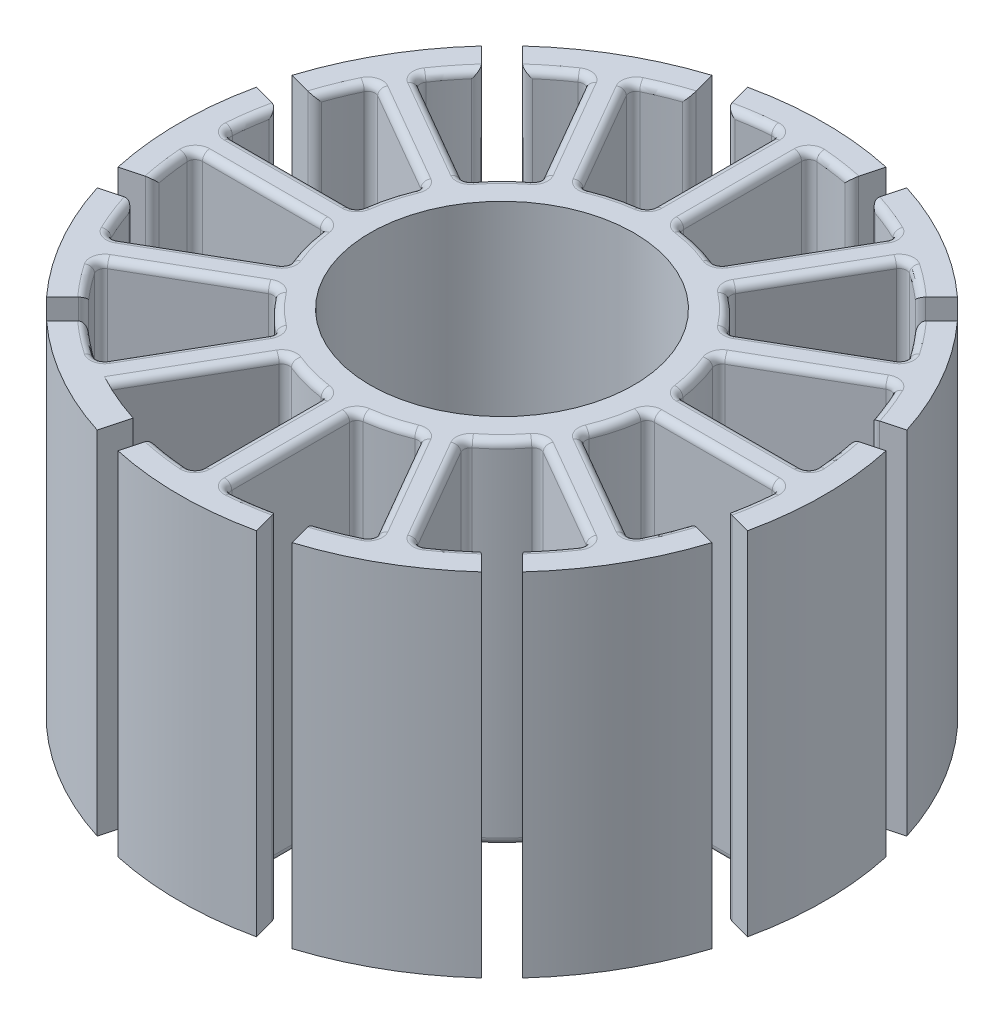
from build123d import *

# Parameters (mm, degrees)
SKETCH1_R           = 5.5
SKETCH1_R_2         = 4.5
BOSS_EXTRUDE1_DEPTH = 12
FILLET2_R           = 0.25


with BuildPart() as part:
    # Sketch1 → Boss-Extrude1 (new body)
    # profile 1 of 25: a face of its own
    with BuildSketch(Plane(origin=(0, 0, 0), x_dir=(1, 0, 0), z_dir=(0, 1, 0))):
        Circle(SKETCH1_R)
        with Locations(Location((0, 0, 0), (0, 0, 270))):
            Circle(SKETCH1_R_2, mode=Mode.SUBTRACT)
    # profile 2 of 25: a face of its own
    with BuildSketch(Plane(origin=(0, 0, 0), x_dir=(1, 0, 0), z_dir=(0, 1, 0))):
        with BuildLine():
            ThreePointArc((-4.49341649, -3.171625489), (-4.763139721, -2.75), (-4.99341649, -2.305600086))
            Line((-4.99341649, -2.305600086), (-8.899421946, -4.560733387))
            ThreePointArc((-8.899421946, -4.560733387), (-8.660254038, -5), (-8.399421946, -5.426758791))
            Line((-8.399421946, -5.426758791), (-4.49341649, -3.171625489))
        make_face()
    # profile 3 of 25: a face of its own
    with BuildSketch(Plane(origin=(0, 0, 0), x_dir=(1, 0, 0), z_dir=(0, 1, 0))):
        with BuildLine():
            ThreePointArc((-5.477225575, -0.5), (-5.5, 0), (-5.477225575, 0.5))
            Line((-5.477225575, 0.5), (-9.987492178, 0.5))
            ThreePointArc((-9.987492178, 0.5), (-10, 0), (-9.987492178, -0.5))
            Line((-9.987492178, -0.5), (-5.477225575, -0.5))
        make_face()
    # profile 4 of 25: a face of its own
    with BuildSketch(Plane(origin=(0, 0, 0), x_dir=(1, 0, 0), z_dir=(0, 1, 0))):
        with BuildLine():
            ThreePointArc((-4.99341649, 2.305600086), (-4.763139721, 2.75), (-4.49341649, 3.171625489))
            Line((-4.49341649, 3.171625489), (-8.399421946, 5.426758791))
            ThreePointArc((-8.399421946, 5.426758791), (-8.660254038, 5), (-8.899421946, 4.560733387))
            Line((-8.899421946, 4.560733387), (-4.99341649, 2.305600086))
        make_face()
    # profile 5 of 25: a face of its own
    with BuildSketch(Plane(origin=(0, 0, 0), x_dir=(1, 0, 0), z_dir=(0, 1, 0))):
        with BuildLine():
            ThreePointArc((-3.171625489, 4.49341649), (-2.75, 4.763139721), (-2.305600086, 4.99341649))
            Line((-2.305600086, 4.99341649), (-4.560733387, 8.899421946))
            ThreePointArc((-4.560733387, 8.899421946), (-5, 8.660254038), (-5.426758791, 8.399421946))
            Line((-5.426758791, 8.399421946), (-3.171625489, 4.49341649))
        make_face()
    # profile 6 of 25: a face of its own
    with BuildSketch(Plane(origin=(0, 0, 0), x_dir=(1, 0, 0), z_dir=(0, 1, 0))):
        with BuildLine():
            ThreePointArc((0.5, 9.987492178), (0, 10), (-0.5, 9.987492178))
            Line((-0.5, 9.987492178), (-0.5, 5.477225575))
            ThreePointArc((-0.5, 5.477225575), (0, 5.5), (0.5, 5.477225575))
            Line((0.5, 5.477225575), (0.5, 9.987492178))
        make_face()
    # profile 7 of 25: a face of its own
    with BuildSketch(Plane(origin=(0, 0, 0), x_dir=(1, 0, 0), z_dir=(0, 1, 0))):
        with BuildLine():
            Line((4.560733387, 8.899421946), (2.305600086, 4.99341649))
            ThreePointArc((2.305600086, 4.99341649), (2.75, 4.763139721), (3.171625489, 4.49341649))
            Line((3.171625489, 4.49341649), (5.426758791, 8.399421946))
            ThreePointArc((5.426758791, 8.399421946), (5, 8.660254038), (4.560733387, 8.899421946))
        make_face()
    # profile 8 of 25: a face of its own
    with BuildSketch(Plane(origin=(0, 0, 0), x_dir=(1, 0, 0), z_dir=(0, 1, 0))):
        with BuildLine():
            Line((8.399421946, 5.426758791), (4.49341649, 3.171625489))
            ThreePointArc((4.49341649, 3.171625489), (4.763139721, 2.75), (4.99341649, 2.305600086))
            Line((4.99341649, 2.305600086), (8.899421946, 4.560733387))
            ThreePointArc((8.899421946, 4.560733387), (8.660254038, 5), (8.399421946, 5.426758791))
        make_face()
    # profile 9 of 25: a face of its own
    with BuildSketch(Plane(origin=(0, 0, 0), x_dir=(1, 0, 0), z_dir=(0, 1, 0))):
        with BuildLine():
            Line((9.987492178, 0.5), (5.477225575, 0.5))
            ThreePointArc((5.477225575, 0.5), (5.494303444, 0.250259203), (5.5, 0))
            ThreePointArc((5.5, 0), (5.494303444, -0.250259203), (5.477225575, -0.5))
            Line((5.477225575, -0.5), (9.987492178, -0.5))
            ThreePointArc((9.987492178, -0.5), (9.996872555, -0.250078211), (10, 0))
            ThreePointArc((10, 0), (9.996872555, 0.250078211), (9.987492178, 0.5))
        make_face()
    # profile 10 of 25: a face of its own
    with BuildSketch(Plane(origin=(0, 0, 0), x_dir=(1, 0, 0), z_dir=(0, 1, 0))):
        with BuildLine():
            Line((8.899421946, -4.560733387), (4.99341649, -2.305600086))
            ThreePointArc((4.99341649, -2.305600086), (4.763139721, -2.75), (4.49341649, -3.171625489))
            Line((4.49341649, -3.171625489), (8.399421946, -5.426758791))
            ThreePointArc((8.399421946, -5.426758791), (8.660254038, -5), (8.899421946, -4.560733387))
        make_face()
    # profile 11 of 25: a face of its own
    with BuildSketch(Plane(origin=(0, 0, 0), x_dir=(1, 0, 0), z_dir=(0, 1, 0))):
        with BuildLine():
            Line((5.426758791, -8.399421946), (3.171625489, -4.49341649))
            ThreePointArc((3.171625489, -4.49341649), (2.75, -4.763139721), (2.305600086, -4.99341649))
            Line((2.305600086, -4.99341649), (4.560733387, -8.899421946))
            ThreePointArc((4.560733387, -8.899421946), (5, -8.660254038), (5.426758791, -8.399421946))
        make_face()
    # profile 12 of 25: a face of its own
    with BuildSketch(Plane(origin=(0, 0, 0), x_dir=(1, 0, 0), z_dir=(0, 1, 0))):
        with BuildLine():
            ThreePointArc((0.5, -5.477225575), (0, -5.5), (-0.5, -5.477225575))
            Line((-0.5, -5.477225575), (-0.5, -9.987492178))
            ThreePointArc((-0.5, -9.987492178), (0, -10), (0.5, -9.987492178))
            Line((0.5, -9.987492178), (0.5, -5.477225575))
        make_face()
    # profile 13 of 25: a face of its own
    with BuildSketch(Plane(origin=(0, 0, 0), x_dir=(1, 0, 0), z_dir=(0, 1, 0))):
        with BuildLine():
            ThreePointArc((-2.305600086, -4.99341649), (-2.75, -4.763139721), (-3.171625489, -4.49341649))
            Line((-3.171625489, -4.49341649), (-5.426758791, -8.399421946))
            ThreePointArc((-5.426758791, -8.399421946), (-5, -8.660254038), (-4.560733387, -8.899421946))
            Line((-4.560733387, -8.899421946), (-2.305600086, -4.99341649))
        make_face()
    # profile 14 of 25: a face of its own
    with BuildSketch(Plane(origin=(0, 0, 0), x_dir=(1, 0, 0), z_dir=(0, 1, 0))):
        with BuildLine():
            ThreePointArc((-4.560733387, -8.899421946), (-5, -8.660254038), (-5.426758791, -8.399421946))
            ThreePointArc((-5.426758791, -8.399421946), (-6.08761429, -7.933533403), (-6.708670055, -7.415776837))
            Line((-6.708670055, -7.415776837), (-7.416581743, -8.123688525))
            ThreePointArc((-7.416581743, -8.123688525), (-5.5, -9.526279442), (-3.327029763, -10.484792461))
            Line((-3.327029763, -10.484792461), (-3.067916102, -9.517767112))
            ThreePointArc((-3.067916102, -9.517767112), (-3.826834324, -9.238795325), (-4.560733387, -8.899421946))
        make_face()
    # profile 15 of 25: a face of its own
    with BuildSketch(Plane(origin=(0, 0, 0), x_dir=(1, 0, 0), z_dir=(0, 1, 0))):
        with BuildLine():
            ThreePointArc((-8.399421946, -5.426758791), (-8.660254038, -5), (-8.899421946, -4.560733387))
            ThreePointArc((-8.899421946, -4.560733387), (-9.238795325, -3.826834324), (-9.517767112, -3.067916102))
            Line((-9.517767112, -3.067916102), (-10.484792461, -3.327029763))
            ThreePointArc((-10.484792461, -3.327029763), (-9.526279442, -5.5), (-8.123688525, -7.416581743))
            Line((-8.123688525, -7.416581743), (-7.415776837, -6.708670055))
            ThreePointArc((-7.415776837, -6.708670055), (-7.933533403, -6.08761429), (-8.399421946, -5.426758791))
        make_face()
    # profile 16 of 25: a face of its own
    with BuildSketch(Plane(origin=(0, 0, 0), x_dir=(1, 0, 0), z_dir=(0, 1, 0))):
        with BuildLine():
            ThreePointArc((-9.987492178, -0.5), (-10, 0), (-9.987492178, 0.5))
            ThreePointArc((-9.987492178, 0.5), (-9.914448614, 1.305261922), (-9.776586157, 2.101990275))
            Line((-9.776586157, 2.101990275), (-10.743611506, 2.361103937))
            ThreePointArc((-10.743611506, 2.361103937), (-11, 0), (-10.743611506, -2.361103937))
            Line((-10.743611506, -2.361103937), (-9.776586157, -2.101990275))
            ThreePointArc((-9.776586157, -2.101990275), (-9.914448614, -1.305261922), (-9.987492178, -0.5))
        make_face()
    # profile 17 of 25: a face of its own
    with BuildSketch(Plane(origin=(0, 0, 0), x_dir=(1, 0, 0), z_dir=(0, 1, 0))):
        with BuildLine():
            ThreePointArc((-4.560733387, 8.899421946), (-3.826834324, 9.238795325), (-3.067916102, 9.517767112))
            Line((-3.067916102, 9.517767112), (-3.327029763, 10.484792461))
            ThreePointArc((-3.327029763, 10.484792461), (-5.5, 9.526279442), (-7.416581743, 8.123688525))
            Line((-7.416581743, 8.123688525), (-6.708670055, 7.415776837))
            ThreePointArc((-6.708670055, 7.415776837), (-6.08761429, 7.933533403), (-5.426758791, 8.399421946))
            ThreePointArc((-5.426758791, 8.399421946), (-5, 8.660254038), (-4.560733387, 8.899421946))
        make_face()
    # profile 18 of 25: a face of its own
    with BuildSketch(Plane(origin=(0, 0, 0), x_dir=(1, 0, 0), z_dir=(0, 1, 0))):
        with BuildLine():
            ThreePointArc((-8.899421946, 4.560733387), (-8.660254038, 5), (-8.399421946, 5.426758791))
            ThreePointArc((-8.399421946, 5.426758791), (-7.933533403, 6.08761429), (-7.415776837, 6.708670055))
            Line((-7.415776837, 6.708670055), (-8.123688525, 7.416581743))
            ThreePointArc((-8.123688525, 7.416581743), (-9.526279442, 5.5), (-10.484792461, 3.327029763))
            Line((-10.484792461, 3.327029763), (-9.517767112, 3.067916102))
            ThreePointArc((-9.517767112, 3.067916102), (-9.238795325, 3.826834324), (-8.899421946, 4.560733387))
        make_face()
    # profile 19 of 25: a face of its own
    with BuildSketch(Plane(origin=(0, 0, 0), x_dir=(1, 0, 0), z_dir=(0, 1, 0))):
        with BuildLine():
            ThreePointArc((-2.101990275, 9.776586157), (-1.305261922, 9.914448614), (-0.5, 9.987492178))
            ThreePointArc((-0.5, 9.987492178), (0, 10), (0.5, 9.987492178))
            ThreePointArc((0.5, 9.987492178), (1.305261922, 9.914448614), (2.101990275, 9.776586157))
            Line((2.101990275, 9.776586157), (2.361103937, 10.743611506))
            ThreePointArc((2.361103937, 10.743611506), (0, 11), (-2.361103937, 10.743611506))
            Line((-2.361103937, 10.743611506), (-2.101990275, 9.776586157))
        make_face()
    # profile 20 of 25: a face of its own
    with BuildSketch(Plane(origin=(0, 0, 0), x_dir=(1, 0, 0), z_dir=(0, 1, 0))):
        with BuildLine():
            Line((3.327029763, 10.484792461), (3.067916102, 9.517767112))
            ThreePointArc((3.067916102, 9.517767112), (3.826834324, 9.238795325), (4.560733387, 8.899421946))
            ThreePointArc((4.560733387, 8.899421946), (5, 8.660254038), (5.426758791, 8.399421946))
            ThreePointArc((5.426758791, 8.399421946), (6.08761429, 7.933533403), (6.708670055, 7.415776837))
            Line((6.708670055, 7.415776837), (7.416581743, 8.123688525))
            ThreePointArc((7.416581743, 8.123688525), (5.5, 9.526279442), (3.327029763, 10.484792461))
        make_face()
    # profile 21 of 25: a face of its own
    with BuildSketch(Plane(origin=(0, 0, 0), x_dir=(1, 0, 0), z_dir=(0, 1, 0))):
        with BuildLine():
            ThreePointArc((7.415776837, 6.708670055), (7.933533403, 6.08761429), (8.399421946, 5.426758791))
            ThreePointArc((8.399421946, 5.426758791), (8.660254038, 5), (8.899421946, 4.560733387))
            ThreePointArc((8.899421946, 4.560733387), (9.238795325, 3.826834324), (9.517767112, 3.067916102))
            Line((9.517767112, 3.067916102), (10.484792461, 3.327029763))
            ThreePointArc((10.484792461, 3.327029763), (9.526279442, 5.5), (8.123688525, 7.416581743))
            Line((8.123688525, 7.416581743), (7.415776837, 6.708670055))
        make_face()
    # profile 22 of 25: a face of its own
    with BuildSketch(Plane(origin=(0, 0, 0), x_dir=(1, 0, 0), z_dir=(0, 1, 0))):
        with BuildLine():
            ThreePointArc((9.776586157, 2.101990275), (9.914448614, 1.305261922), (9.987492178, 0.5))
            ThreePointArc((9.987492178, 0.5), (9.996872555, 0.250078211), (10, 0))
            ThreePointArc((10, 0), (9.996872555, -0.250078211), (9.987492178, -0.5))
            ThreePointArc((9.987492178, -0.5), (9.914448614, -1.305261922), (9.776586157, -2.101990275))
            Line((9.776586157, -2.101990275), (10.743611506, -2.361103937))
            ThreePointArc((10.743611506, -2.361103937), (10.935715033, -1.187491775), (11, 0))
            ThreePointArc((11, 0), (10.935715033, 1.187491775), (10.743611506, 2.361103937))
            Line((10.743611506, 2.361103937), (9.776586157, 2.101990275))
        make_face()
    # profile 23 of 25: a face of its own
    with BuildSketch(Plane(origin=(0, 0, 0), x_dir=(1, 0, 0), z_dir=(0, 1, 0))):
        with BuildLine():
            ThreePointArc((9.517767112, -3.067916102), (9.238795325, -3.826834324), (8.899421946, -4.560733387))
            ThreePointArc((8.899421946, -4.560733387), (8.660254038, -5), (8.399421946, -5.426758791))
            ThreePointArc((8.399421946, -5.426758791), (7.933533403, -6.08761429), (7.415776837, -6.708670055))
            Line((7.415776837, -6.708670055), (8.123688525, -7.416581743))
            ThreePointArc((8.123688525, -7.416581743), (9.526279442, -5.5), (10.484792461, -3.327029763))
            Line((10.484792461, -3.327029763), (9.517767112, -3.067916102))
        make_face()
    # profile 24 of 25: a face of its own
    with BuildSketch(Plane(origin=(0, 0, 0), x_dir=(1, 0, 0), z_dir=(0, 1, 0))):
        with BuildLine():
            ThreePointArc((6.708670055, -7.415776837), (6.08761429, -7.933533403), (5.426758791, -8.399421946))
            ThreePointArc((5.426758791, -8.399421946), (5, -8.660254038), (4.560733387, -8.899421946))
            ThreePointArc((4.560733387, -8.899421946), (3.826834324, -9.238795325), (3.067916102, -9.517767112))
            Line((3.067916102, -9.517767112), (3.327029763, -10.484792461))
            ThreePointArc((3.327029763, -10.484792461), (5.5, -9.526279442), (7.416581743, -8.123688525))
            Line((7.416581743, -8.123688525), (6.708670055, -7.415776837))
        make_face()
    # profile 25 of 25: a face of its own
    with BuildSketch(Plane(origin=(0, 0, 0), x_dir=(1, 0, 0), z_dir=(0, 1, 0))):
        with BuildLine():
            ThreePointArc((0.5, -9.987492178), (0, -10), (-0.5, -9.987492178))
            ThreePointArc((-0.5, -9.987492178), (-1.305261922, -9.914448614), (-2.101990275, -9.776586157))
            Line((-2.101990275, -9.776586157), (-2.361103937, -10.743611506))
            ThreePointArc((-2.361103937, -10.743611506), (0, -11), (2.361103937, -10.743611506))
            Line((2.361103937, -10.743611506), (2.101990275, -9.776586157))
            ThreePointArc((2.101990275, -9.776586157), (1.305261922, -9.914448614), (0.5, -9.987492178))
        make_face()
    extrude(amount=BOSS_EXTRUDE1_DEPTH)

    # Fillet2
    fillet2_edges = [part.edges().sort_by_distance(p)[0] for p in [
        (0.5, 0, 7.732358876),
        (0.5, 12, 7.732358876),
        (3.433166736, 0, 6.946419218),
        (3.433166736, 12, 6.946419218),
        (-3.433166736, 0, 6.946419218),
        (-3.433166736, 12, 6.946419218),
        (-0.5, 0, 7.732358876),
        (-0.5, 12, 7.732358876),
        (-6.446419218, 0, 4.29919214),
        (-6.446419218, 12, 4.29919214),
        (-4.29919214, 0, 6.446419218),
        (-4.29919214, 12, 6.446419218),
        (-7.732358876, 0, 0.5),
        (-7.732358876, 12, 0.5),
        (-6.946419218, 0, 3.433166736),
        (-6.946419218, 12, 3.433166736),
        (-6.946419218, 0, -3.433166736),
        (-6.946419218, 12, -3.433166736),
        (-7.732358876, 0, -0.5),
        (-7.732358876, 12, -0.5),
        (-4.29919214, 0, -6.446419218),
        (-4.29919214, 12, -6.446419218),
        (-6.446419218, 0, -4.29919214),
        (-6.446419218, 12, -4.29919214),
        (-0.5, 0, -7.732358876),
        (-0.5, 12, -7.732358876),
        (-3.433166736, 0, -6.946419218),
        (-3.433166736, 12, -6.946419218),
        (3.433166736, 0, -6.946419218),
        (3.433166736, 12, -6.946419218),
        (0.5, 0, -7.732358876),
        (0.5, 12, -7.732358876),
        (6.446419218, 0, -4.29919214),
        (6.446419218, 12, -4.29919214),
        (4.29919214, 0, -6.446419218),
        (4.29919214, 12, -6.446419218),
        (7.732358876, 0, -0.5),
        (7.732358876, 12, -0.5),
        (6.946419218, 0, -3.433166736),
        (6.946419218, 12, -3.433166736),
        (6.946419218, 0, 3.433166736),
        (6.946419218, 12, 3.433166736),
        (7.732358876, 0, 0.5),
        (7.732358876, 12, 0.5),
        (4.29919214, 0, 6.446419218),
        (4.29919214, 12, 6.446419218),
        (6.446419218, 0, 4.29919214),
        (6.446419218, 12, 4.29919214),
        (0.5, 6, 5.477225575),
        (1.423504748, 12, 5.312592045),
        (1.423504748, 0, 5.312592045),
        (2.305600086, 6, 4.99341649),
        (-2.305600086, 6, 4.99341649),
        (-1.423504748, 12, 5.312592045),
        (-1.423504748, 0, 5.312592045),
        (-0.5, 6, 5.477225575),
        (-4.49341649, 6, 3.171625489),
        (-3.889087297, 12, 3.889087297),
        (-3.889087297, 0, 3.889087297),
        (-3.171625489, 6, 4.49341649),
        (-5.477225575, 6, 0.5),
        (-5.312592045, 12, 1.423504748),
        (-5.312592045, 0, 1.423504748),
        (-4.99341649, 6, 2.305600086),
        (-4.99341649, 6, -2.305600086),
        (-5.312592045, 12, -1.423504748),
        (-5.312592045, 0, -1.423504748),
        (-5.477225575, 6, -0.5),
        (-3.171625489, 6, -4.49341649),
        (-3.889087297, 12, -3.889087297),
        (-3.889087297, 0, -3.889087297),
        (-4.49341649, 6, -3.171625489),
        (-0.5, 6, -5.477225575),
        (-1.423504748, 12, -5.312592045),
        (-1.423504748, 0, -5.312592045),
        (-2.305600086, 6, -4.99341649),
        (2.305600086, 6, -4.99341649),
        (1.423504748, 12, -5.312592045),
        (1.423504748, 0, -5.312592045),
        (0.5, 6, -5.477225575),
        (4.49341649, 6, -3.171625489),
        (3.889087297, 12, -3.889087297),
        (3.889087297, 0, -3.889087297),
        (3.171625489, 6, -4.49341649),
        (5.477225575, 6, -0.5),
        (5.312592045, 12, -1.423504748),
        (5.312592045, 0, -1.423504748),
        (4.99341649, 6, -2.305600086),
        (4.99341649, 6, 2.305600086),
        (5.312592045, 12, 1.423504748),
        (5.312592045, 0, 1.423504748),
        (5.477225575, 6, 0.5),
        (3.171625489, 6, 4.49341649),
        (3.889087297, 12, 3.889087297),
        (3.889087297, 0, 3.889087297),
        (4.49341649, 6, 3.171625489),
        (8.899421946, 6, -4.560733387),
        (9.238795325, 12, -3.826834324),
        (9.238795325, 0, -3.826834324),
        (9.517767112, 6, -3.067916102),
        (7.415776837, 6, -6.708670055),
        (7.933533403, 12, -6.08761429),
        (7.933533403, 0, -6.08761429),
        (8.399421946, 6, -5.426758791),
        (5.426758791, 6, -8.399421946),
        (6.08761429, 12, -7.933533403),
        (6.08761429, 0, -7.933533403),
        (6.708670055, 6, -7.415776837),
        (3.067916102, 6, -9.517767112),
        (3.826834324, 12, -9.238795325),
        (3.826834324, 0, -9.238795325),
        (4.560733387, 6, -8.899421946),
        (0.5, 6, -9.987492178),
        (1.305261922, 12, -9.914448614),
        (1.305261922, 0, -9.914448614),
        (2.101990275, 6, -9.776586157),
        (-2.101990275, 6, -9.776586157),
        (-1.305261922, 12, -9.914448614),
        (-1.305261922, 0, -9.914448614),
        (-0.5, 6, -9.987492178),
        (-4.560733387, 6, -8.899421946),
        (-3.826834324, 12, -9.238795325),
        (-3.826834324, 0, -9.238795325),
        (-3.067916102, 6, -9.517767112),
        (-6.708670055, 6, -7.415776837),
        (-6.08761429, 12, -7.933533403),
        (-6.08761429, 0, -7.933533403),
        (-5.426758791, 6, -8.399421946),
        (-8.399421946, 6, -5.426758791),
        (-7.933533403, 12, -6.08761429),
        (-7.933533403, 0, -6.08761429),
        (-7.415776837, 6, -6.708670055),
        (-9.517767112, 6, -3.067916102),
        (-9.238795325, 12, -3.826834324),
        (-9.238795325, 0, -3.826834324),
        (-8.899421946, 6, -4.560733387),
        (-9.987492178, 6, -0.5),
        (-9.914448614, 12, -1.305261922),
        (-9.914448614, 0, -1.305261922),
        (-9.776586157, 6, -2.101990275),
        (-9.776586157, 6, 2.101990275),
        (-9.914448614, 12, 1.305261922),
        (-9.914448614, 0, 1.305261922),
        (-9.987492178, 6, 0.5),
        (-8.899421946, 6, 4.560733387),
        (-9.238795325, 12, 3.826834324),
        (-9.238795325, 0, 3.826834324),
        (-9.517767112, 6, 3.067916102),
        (-7.415776837, 6, 6.708670055),
        (-7.933533403, 12, 6.08761429),
        (-7.933533403, 0, 6.08761429),
        (-8.399421946, 6, 5.426758791),
        (-5.426758791, 6, 8.399421946),
        (-6.08761429, 12, 7.933533403),
        (-6.08761429, 0, 7.933533403),
        (-6.708670055, 6, 7.415776837),
        (-0.5, 6, 9.987492178),
        (-1.305261922, 12, 9.914448614),
        (-1.305261922, 0, 9.914448614),
        (-2.101990275, 6, 9.776586157),
        (2.101990275, 6, 9.776586157),
        (1.305261922, 12, 9.914448614),
        (1.305261922, 0, 9.914448614),
        (0.5, 6, 9.987492178),
        (9.776586157, 6, -2.101990275),
        (9.914448614, 12, -1.305261922),
        (9.914448614, 0, -1.305261922),
        (9.987492178, 6, -0.5),
        (9.987492178, 6, 0.5),
        (9.914448614, 12, 1.305261922),
        (9.914448614, 0, 1.305261922),
        (9.776586157, 6, 2.101990275),
        (9.517767112, 6, 3.067916102),
        (9.238795325, 12, 3.826834324),
        (9.238795325, 0, 3.826834324),
        (8.899421946, 6, 4.560733387),
        (8.399421946, 6, 5.426758791),
        (7.933533403, 12, 6.08761429),
        (7.933533403, 0, 6.08761429),
        (7.415776837, 6, 6.708670055),
        (6.708670055, 6, 7.415776837),
        (6.08761429, 12, 7.933533403),
        (6.08761429, 0, 7.933533403),
        (5.426758791, 6, 8.399421946),
        (4.560733387, 6, 8.899421946),
        (3.826834324, 12, 9.238795325),
        (3.826834324, 0, 9.238795325),
        (3.067916102, 6, 9.517767112),
    ]]
    fillet(fillet2_edges, radius=FILLET2_R)


solid = part.part
